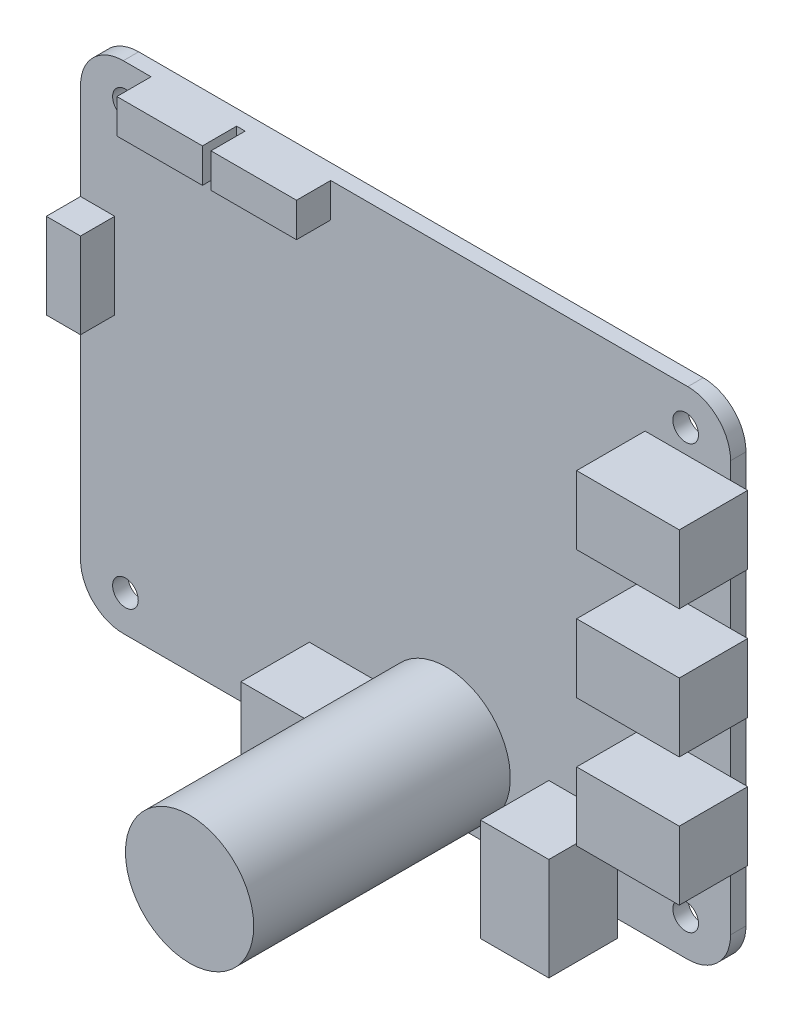
from build123d import *

# Parameters (mm, degrees)
SKETCH_1_W      = 76
SKETCH_1_H      = 58
SKETCH_1_R      = 1.5
EXTRUDE_1_DEPTH = 1.8
SKETCH_2_W      = 12
SKETCH_2_H      = 8
SKETCH_2_W_2    = 8
SKETCH_2_H_2    = 12
EXTRUDE_2_DEPTH = 8
SKETCH_3_W      = 10
SKETCH_3_H      = 4
SKETCH_3_W_2    = 4
SKETCH_3_H_2    = 10
EXTRUDE_3_DEPTH = 4
SKETCH_4_R      = 7.5
EXTRUDE_4_DEPTH = 30
FILLET_1_R      = 5


with BuildPart() as part:
    # 草图1 → 凸台-拉伸1 (new body)
    with BuildSketch(Plane.XY):
        Rectangle(SKETCH_1_W, SKETCH_1_H)
        with Locations((-32.75, 24.75)):
            Circle(SKETCH_1_R, mode=Mode.SUBTRACT)
        with Locations((-32.75, -24.75)):
            Circle(SKETCH_1_R, mode=Mode.SUBTRACT)
        with Locations((32.75, -24.75)):
            Circle(SKETCH_1_R, mode=Mode.SUBTRACT)
        with Locations((32.75, 24.75)):
            Circle(SKETCH_1_R, mode=Mode.SUBTRACT)
    extrude(amount=EXTRUDE_1_DEPTH)

    # 草图2 → 凸台-拉伸2 (add)
    with BuildSketch(Plane.XY.offset(1.8)):
        with Locations((34, 18)):
            Rectangle(SKETCH_2_W, SKETCH_2_H)
        with Locations((34, 3)):
            Rectangle(SKETCH_2_W, SKETCH_2_H)
        with Locations((34, -12)):
            Rectangle(SKETCH_2_W, SKETCH_2_H)
        with Locations((-7.25, -25)):
            Rectangle(SKETCH_2_W_2, SKETCH_2_H_2)
        with Locations((20.75, -25)):
            Rectangle(SKETCH_2_W_2, SKETCH_2_H_2)
    extrude(amount=EXTRUDE_2_DEPTH)

    # 草图3 → 凸台-拉伸3 (add)
    with BuildSketch(Plane.XY.offset(1.8)):
        with Locations((-24.75, 27)):
            Rectangle(SKETCH_3_W, SKETCH_3_H)
        with Locations((-13.75, 27)):
            Rectangle(SKETCH_3_W, SKETCH_3_H)
        with Locations((-36, 7.75)):
            Rectangle(SKETCH_3_W_2, SKETCH_3_H_2)
    extrude(amount=EXTRUDE_3_DEPTH)

    # 草图4 → 凸台-拉伸4 (add)
    with BuildSketch(Plane.XY.offset(1.8)):
        with Locations(Location((4.75, -21, 0), (0, 0, 180))):
            Circle(SKETCH_4_R)
    extrude(amount=EXTRUDE_4_DEPTH)

    # 圆角1
    fillet_1_edges = [part.edges().sort_by_distance(p)[0] for p in [
        (38, -29, 0.9),
        (-38, -29, 0.9),
        (-38, 29, 0.9),
        (38, 29, 0.9),
    ]]
    fillet(fillet_1_edges, radius=FILLET_1_R)


solid = part.part
